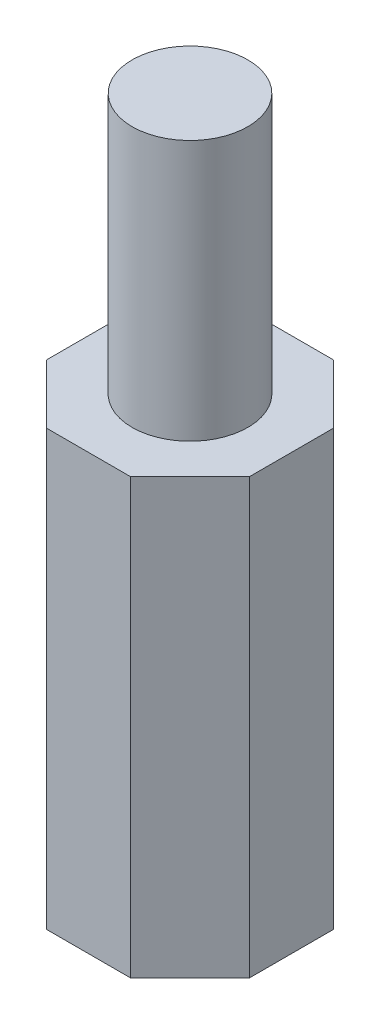
from build123d import *

# Parameters (mm, degrees)
EXTRUSION1_DEPTH        = 7.5
ESQUISSE2_R             = 2
EXTRUSION2_DEPTH        = 9
ESQUISSE3_R             = 2
ENL_V_MAT_EXTRU_1_DEPTH = 9


with BuildPart() as part:
    # Esquisse1 → Extrusion1 (new, symmetric)
    with BuildSketch(Plane(origin=(0, 0, 0), x_dir=(1, 0, 0), z_dir=(0, 1, 0))):
        Polygon((-1.449747468, 3.5), (1.449747468, 3.5), (3.5, 1.449747468), (3.5, -1.449747468), (1.449747468, -3.5), (-1.449747468, -3.5), (-3.5, -1.449747468), (-3.5, 1.449747468), align=None)
    extrude(amount=EXTRUSION1_DEPTH, both=True)

    # Esquisse2 → Extrusion2 (add)
    with BuildSketch(Plane(origin=(0, 7.5, 0), x_dir=(1, 0, 0), z_dir=(0, 1, 0))):
        with Locations(Location((0, 0, 0), (0, 0, 270))):
            Circle(ESQUISSE2_R)
    extrude(amount=EXTRUSION2_DEPTH)

    # Esquisse3 → Enlèv. mat.-Extru.1 (cut)
    with BuildSketch(Plane.XZ.offset(7.5)):
        with Locations(Location((0, 0, 0), (0, 0, 90))):
            Circle(ESQUISSE3_R)
    extrude(amount=-ENL_V_MAT_EXTRU_1_DEPTH, mode=Mode.SUBTRACT)


solid = part.part
